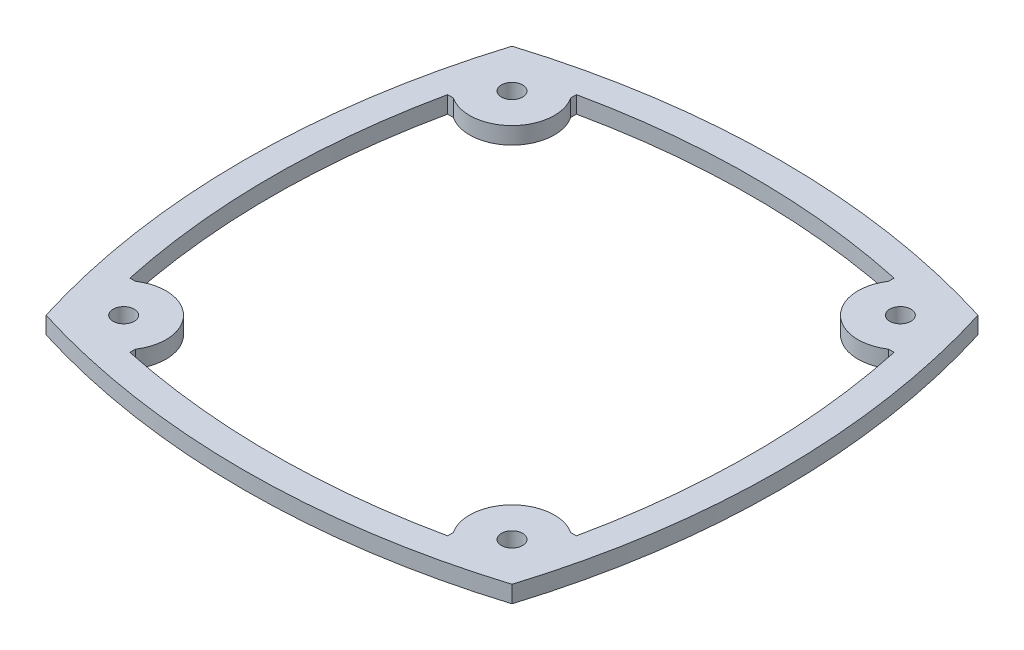
from build123d import *

# Parameters (mm, degrees)
EXTRUDE_1_DEPTH     = 2.4
CUT_EXTRUDE_2_DEPTH = 1
SKETCH_3_R          = 1.5
CUT_EXTRUDE_3_DEPTH = 54.793679926


with BuildPart() as part:
    # 스케치1 → 보스-돌출1 (new body)
    with BuildSketch(Plane(origin=(0, 0, 0), x_dir=(1, 0, 0), z_dir=(0, 1, 0))):
        with BuildLine():
            ThreePointArc((33, -33), (0, -38), (-33, -33))
            ThreePointArc((-33, -33), (-38, 0), (-33, 33))
            ThreePointArc((-33, 33), (0, 38), (33, 33))
            ThreePointArc((33, 33), (38, 0), (33, -33))
        make_face()
        with BuildLine():
            Line((-22.5, 30.81662479), (-22.5, 31.616712956))
            ThreePointArc((-22.5, 31.616712956), (-11.312935706, 33.402516289), (0, 34))
            ThreePointArc((0, 34), (11.312935706, 33.402516289), (22.5, 31.616712956))
            Line((22.5, 31.616712956), (22.5, 30.81662479))
            ThreePointArc((22.5, 30.81662479), (23.257359313, 23.257359313), (30.81662479, 22.5))
            Line((30.81662479, 22.5), (31.616712956, 22.5))
            ThreePointArc((31.616712956, 22.5), (33.402516289, 11.312935706), (34, 0))
            ThreePointArc((34, 0), (33.402516289, -11.312935706), (31.616712956, -22.5))
            Line((31.616712956, -22.5), (30.81662479, -22.5))
            ThreePointArc((30.81662479, -22.5), (23.257359313, -23.257359313), (22.5, -30.81662479))
            Line((22.5, -30.81662479), (22.5, -31.616712956))
            ThreePointArc((22.5, -31.616712956), (11.312935706, -33.402516289), (0, -34))
            ThreePointArc((0, -34), (-11.312935706, -33.402516289), (-22.5, -31.616712956))
            Line((-22.5, -31.616712956), (-22.5, -30.81662479))
            ThreePointArc((-22.5, -30.81662479), (-23.257359313, -23.257359313), (-30.81662479, -22.5))
            Line((-30.81662479, -22.5), (-31.616712956, -22.5))
            ThreePointArc((-31.616712956, -22.5), (-33.402516289, -11.312935706), (-34, 0))
            ThreePointArc((-34, 0), (-33.402516289, 11.312935706), (-31.616712956, 22.5))
            Line((-31.616712956, 22.5), (-30.81662479, 22.5))
            ThreePointArc((-30.81662479, 22.5), (-23.257359313, 23.257359313), (-22.5, 30.81662479))
        make_face(mode=Mode.SUBTRACT)
    extrude(amount=EXTRUDE_1_DEPTH)

    # 스케치2 → 컷-돌출2 (cut)
    with BuildSketch(Plane(origin=(0, 0, 0), x_dir=(1, 0, 0), z_dir=(0, 1, 0))):
        with BuildLine():
            Line((-24.5, 30.145751311), (-24.5, 33.220870434))
            ThreePointArc((-24.5, 33.220870434), (-12.328534192, 35.302655242), (0, 35.999543016))
            ThreePointArc((0, 35.999543016), (12.328534192, 35.302655242), (24.5, 33.220870434))
            Line((24.5, 33.220870434), (24.5, 30.145751311))
            ThreePointArc((24.5, 30.145751311), (24.671572875, 24.671572875), (30.145751311, 24.5))
            Line((30.145751311, 24.5), (33.220870434, 24.5))
            ThreePointArc((33.220870434, 24.5), (35.302655242, 12.328534192), (35.999543016, 0))
            ThreePointArc((35.999543016, 0), (35.302655242, -12.328534192), (33.220870434, -24.5))
            Line((33.220870434, -24.5), (30.145751311, -24.5))
            ThreePointArc((30.145751311, -24.5), (24.671572875, -24.671572875), (24.5, -30.145751311))
            Line((24.5, -30.145751311), (24.5, -33.220870434))
            ThreePointArc((24.5, -33.220870434), (12.328534192, -35.302655242), (0, -35.999543016))
            ThreePointArc((0, -35.999543016), (-12.328534192, -35.302655242), (-24.5, -33.220870434))
            Line((-24.5, -33.220870434), (-24.5, -30.145751311))
            ThreePointArc((-24.5, -30.145751311), (-24.671572875, -24.671572875), (-30.145751311, -24.5))
            Line((-30.145751311, -24.5), (-33.220870434, -24.5))
            ThreePointArc((-33.220870434, -24.5), (-35.302655242, -12.328534192), (-35.999543016, 0))
            ThreePointArc((-35.999543016, 0), (-35.302655242, 12.328534192), (-33.220870434, 24.5))
            Line((-33.220870434, 24.5), (-30.145751311, 24.5))
            ThreePointArc((-30.145751311, 24.5), (-24.671572875, 24.671572875), (-24.5, 30.145751311))
        make_face()
        with BuildLine():
            Line((-23.5, 30.5), (-23.5, 32.421599525))
            ThreePointArc((-23.5, 32.421599525), (-11.820488491, 34.353129782), (0, 34.999543016))
            ThreePointArc((0, 34.999543016), (11.820488491, 34.353129782), (23.5, 32.421599525))
            Line((23.5, 32.421599525), (23.5, 30.5))
            ThreePointArc((23.5, 30.5), (23.964466094, 23.964466094), (30.5, 23.5))
            Line((30.5, 23.5), (32.421599525, 23.5))
            ThreePointArc((32.421599525, 23.5), (34.353129782, 11.820488491), (34.999543016, 0))
            ThreePointArc((34.999543016, 0), (34.353129782, -11.820488491), (32.421599525, -23.5))
            Line((32.421599525, -23.5), (30.5, -23.5))
            ThreePointArc((30.5, -23.5), (23.964466094, -23.964466094), (23.5, -30.5))
            Line((23.5, -30.5), (23.5, -32.421599525))
            ThreePointArc((23.5, -32.421599525), (11.820488491, -34.353129782), (0, -34.999543016))
            ThreePointArc((0, -34.999543016), (-11.820488491, -34.353129782), (-23.5, -32.421599525))
            Line((-23.5, -32.421599525), (-23.5, -30.5))
            ThreePointArc((-23.5, -30.5), (-23.964466094, -23.964466094), (-30.5, -23.5))
            Line((-30.5, -23.5), (-32.421599525, -23.5))
            ThreePointArc((-32.421599525, -23.5), (-34.353129782, -11.820488491), (-34.999543016, 0))
            ThreePointArc((-34.999543016, 0), (-34.353129782, 11.820488491), (-32.421599525, 23.5))
            Line((-32.421599525, 23.5), (-30.5, 23.5))
            ThreePointArc((-30.5, 23.5), (-23.964466094, 23.964466094), (-23.5, 30.5))
        make_face(mode=Mode.SUBTRACT)
    extrude(amount=CUT_EXTRUDE_2_DEPTH, mode=Mode.SUBTRACT)

    # 스케치3 → 컷-돌출3 (cut, through all)
    with BuildSketch(Plane(origin=(0, 0, 0), x_dir=(1, 0, 0), z_dir=(0, 1, 0))):
        with Locations(Location((-27.5, 27.5, 0), (0, 0, 270))):
            Circle(SKETCH_3_R)
        with Locations(Location((27.5, 27.5, 0), (0, 0, 270))):
            Circle(SKETCH_3_R)
        with Locations(Location((27.5, -27.5, 0), (0, 0, 270))):
            Circle(SKETCH_3_R)
        with Locations(Location((-27.5, -27.5, 0), (0, 0, 270))):
            Circle(SKETCH_3_R)
    extrude(amount=CUT_EXTRUDE_3_DEPTH, mode=Mode.SUBTRACT)


solid = part.part
